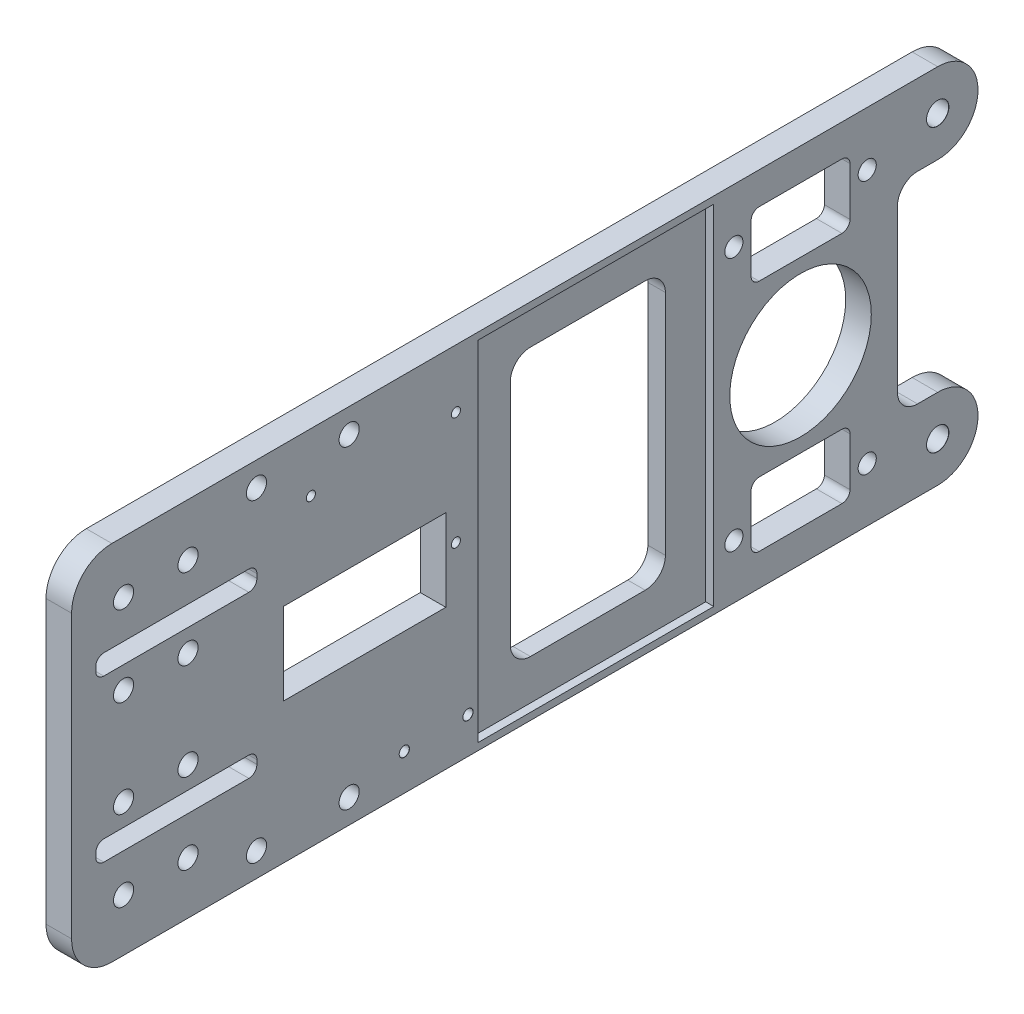
from build123d import *

# Parameters (mm, degrees)
SKETCH1_W                            = 90
SKETCH1_H                            = 225
SKETCH1_R                            = 17.5641
BOSS_EXTRUDE1_DEPTH                  = 3.175
SKETCH2_W                            = 78.1
SKETCH2_H                            = 43.1
BOSS_EXTRUDE2_DEPTH                  = 8.73125
M4_CLEARANCE_HOLE2_AT_2_COUNT        = 2
M4_CLEARANCE_HOLE2_AT_2_PITCH        = 33.1
M4_CLEARANCE_HOLE2_AT_3_COUNT        = 2
M4_CLEARANCE_HOLE2_AT_3_PITCH        = 71.254613886
M4_CLEARANCE_HOLE2_AT_4_COUNT        = 2
M4_CLEARANCE_HOLE2_AT_4_PITCH        = 63.1
SKETCH24_W                           = 78.1
SKETCH24_H                           = 43.1
BOSS_EXTRUDE3_DEPTH                  = 8.73125
TAP_DRILL_FOR_M4X0_7_TAP1_AT_2_COUNT = 2
TAP_DRILL_FOR_M4X0_7_TAP1_AT_2_PITCH = 33.1
TAP_DRILL_FOR_M4X0_7_TAP1_AT_3_COUNT = 2
TAP_DRILL_FOR_M4X0_7_TAP1_AT_3_PITCH = 71.254613886
TAP_DRILL_FOR_M4X0_7_TAP1_AT_4_COUNT = 2
TAP_DRILL_FOR_M4X0_7_TAP1_AT_4_PITCH = 63.1
TAP_DRILL_FOR_M3X0_5_TAP1_AT_2_COUNT = 2
TAP_DRILL_FOR_M3X0_5_TAP1_AT_2_PITCH = 15.8
SKETCH3_R                            = 17.5641
CUT_EXTRUDE3_DEPTH                   = 188.975896477
M5_CLEARANCE_HOLE1_AT_2_COUNT        = 2
M5_CLEARANCE_HOLE1_AT_2_PITCH        = 70
SKETCH14_W                           = 86.5
SKETCH14_H                           = 58.5
CUT_EXTRUDE4_DEPTH                   = 2
FILLET4_R                            = 10
FILLET5_R                            = 5
FILLET6_R                            = 5
SKETCH28_W                           = 15.5
SKETCH28_H                           = 20.75
SKETCH28_R                           = 1.5
BOSS_EXTRUDE4_DEPTH                  = 2.5
FILLET7_R                            = 1
SKETCH29_R                           = 1.5
BOSS_EXTRUDE5_DEPTH                  = 1.5
FILLET8_R                            = 0.5
SKETCH34_W                           = 1.1303
SKETCH34_H                           = 15.08125
TAP_DRILL_FOR_4_40_TAP1_AT_2_COUNT   = 2
TAP_DRILL_FOR_4_40_TAP1_AT_2_PITCH   = 36
TAP_DRILL_FOR_4_40_TAP1_AT_3_COUNT   = 2
TAP_DRILL_FOR_4_40_TAP1_AT_3_PITCH   = 45.607017004
TAP_DRILL_FOR_4_40_TAP1_AT_4_COUNT   = 2
TAP_DRILL_FOR_4_40_TAP1_AT_4_PITCH   = 28
SKETCH36_W                           = 16
SKETCH36_H                           = 24.55
CUT_EXTRUDE6_DEPTH                   = 189.979862105
FILLET9_R                            = 2
FILLET10_R                           = 2
CUT_EXTRUDE7_DEPTH                   = 189.079231247
CUT_EXTRUDE7_DEPTH_BACK              = 189.079231247
CUT_EXTRUDE8_DEPTH                   = 189.079231247
SKETCH39_R                           = 2.5
CUT_EXTRUDE9_DEPTH                   = 189.079231247
SKETCH40_W                           = 40.35
SKETCH40_H                           = 20.35
CUT_EXTRUDE10_DEPTH                  = 189.079231247
FILLET11_R                           = 2
BOSS_EXTRUDE6_DEPTH                  = 12
SKETCH43_W                           = 20.35
SKETCH43_H                           = 2
BOSS_EXTRUDE7_DEPTH                  = 2


with BuildPart() as part:
    # Sketch1 → Boss-Extrude1 (new, symmetric)
    with BuildSketch(Plane.YZ):
        with Locations((0, 68.45)):
            Rectangle(SKETCH1_W, SKETCH1_H)
        with Locations(Location((0, 0, 0), (0, 0, 270))):
            Circle(SKETCH1_R, mode=Mode.SUBTRACT)
    extrude(amount=BOSS_EXTRUDE1_DEPTH, both=True)


with BuildPart() as body_2:
    # Sketch2 → Boss-Extrude2 (new body)
    with BuildSketch(Plane.YZ.offset(3.175)):
        Rectangle(SKETCH2_W, SKETCH2_H)
    extrude(amount=BOSS_EXTRUDE2_DEPTH)


with BuildPart() as m4_clearance_hole2_tool:
    # Sketch23 → M4 Clearance Hole2 (revolve)
    with BuildSketch(Plane(origin=(11.90625, -31.55, 16.55), x_dir=(0, 0, -1), z_dir=(0, 1, 0))):
        Polygon((0, 0), (0, 15.08125), (2.25, 15.08125), (2.25, 0.025), (2.275, 0), align=None)
    m4_clearance_hole2 = revolve(axis=Axis((18.25625, -31.55, 16.55), (-1, 0, 0)))


with BuildPart() as part_1:
    add(part.part)

    # M4 Clearance Hole2: cut by m4_clearance_hole2_tool
    add(m4_clearance_hole2_tool.part, mode=Mode.SUBTRACT)


with BuildPart() as body_2_1:
    add(body_2.part)

    # M4 Clearance Hole2: cut by m4_clearance_hole2_tool
    add(m4_clearance_hole2_tool.part, mode=Mode.SUBTRACT)


with BuildPart() as m4_clearance_hole2_at_2_tool:
    # M4 Clearance Hole2 at 2: M4 Clearance Hole2 ×2
    with Locations(*[(0, 0, -i * M4_CLEARANCE_HOLE2_AT_2_PITCH) for i in range(1, M4_CLEARANCE_HOLE2_AT_2_COUNT)]):
        add(m4_clearance_hole2)


with BuildPart() as part_2:
    add(part_1.part)

    # M4 Clearance Hole2 at 2: cut by m4_clearance_hole2_at_2_tool
    add(m4_clearance_hole2_at_2_tool.part, mode=Mode.SUBTRACT)


with BuildPart() as body_2_2:
    add(body_2_1.part)

    # M4 Clearance Hole2 at 2: cut by m4_clearance_hole2_at_2_tool
    add(m4_clearance_hole2_at_2_tool.part, mode=Mode.SUBTRACT)


with BuildPart() as m4_clearance_hole2_at_3_tool:
    # M4 Clearance Hole2 at 3: M4 Clearance Hole2 ×2
    with Locations(*[Vector(0, 0.8855566897214588, -0.4645313221835228) * (i * M4_CLEARANCE_HOLE2_AT_3_PITCH) for i in range(1, M4_CLEARANCE_HOLE2_AT_3_COUNT)]):
        add(m4_clearance_hole2)


with BuildPart() as part_3:
    add(part_2.part)

    # M4 Clearance Hole2 at 3: cut by m4_clearance_hole2_at_3_tool
    add(m4_clearance_hole2_at_3_tool.part, mode=Mode.SUBTRACT)


with BuildPart() as body_2_3:
    add(body_2_2.part)

    # M4 Clearance Hole2 at 3: cut by m4_clearance_hole2_at_3_tool
    add(m4_clearance_hole2_at_3_tool.part, mode=Mode.SUBTRACT)


with BuildPart() as m4_clearance_hole2_at_4_tool:
    # M4 Clearance Hole2 at 4: M4 Clearance Hole2 ×2
    with Locations(*[(0, i * M4_CLEARANCE_HOLE2_AT_4_PITCH, 0) for i in range(1, M4_CLEARANCE_HOLE2_AT_4_COUNT)]):
        add(m4_clearance_hole2)


with BuildPart() as part_4:
    add(part_3.part)

    # M4 Clearance Hole2 at 4: cut by m4_clearance_hole2_at_4_tool
    add(m4_clearance_hole2_at_4_tool.part, mode=Mode.SUBTRACT)

    # Sketch10 → Tap Drill for M3x0.5 Tap1 (revolve, cut)
    with BuildSketch(Plane(origin=(3.175, -36, 98.35), x_dir=(0, 0, -1), z_dir=(0, 1, 0))):
        Polygon((0, 0), (0, 15.08125), (1.25, 15.08125), (1.25, 0.025), (1.275, 0), align=None)
    tap_drill_for_m3x0_5_tap1 = revolve(axis=Axis((9.525, -36, 98.35), (-1, 0, 0)), mode=Mode.SUBTRACT)

    # Tap Drill for M3x0.5 Tap1 at 2: Tap Drill for M3x0.5 Tap1 ×2
    with Locations(*[(0, 0, -i * TAP_DRILL_FOR_M3X0_5_TAP1_AT_2_PITCH) for i in range(1, TAP_DRILL_FOR_M3X0_5_TAP1_AT_2_COUNT)]):
        add(tap_drill_for_m3x0_5_tap1, mode=Mode.SUBTRACT)

    # Sketch12 → M5 Clearance Hole1 (revolve, cut)
    with BuildSketch(Plane(origin=(3.175, -35, -34.05), x_dir=(0, 0, -1), z_dir=(0, 1, 0))):
        Polygon((0, 0), (0, 15.08125), (2.75, 15.08125), (2.75, 0.025), (2.775, 0), align=None)
    m5_clearance_hole1 = revolve(axis=Axis((9.525, -35, -34.05), (-1, 0, 0)), mode=Mode.SUBTRACT)

    # M5 Clearance Hole1 at 2: M5 Clearance Hole1 ×2
    with Locations(*[(0, i * M5_CLEARANCE_HOLE1_AT_2_PITCH, 0) for i in range(1, M5_CLEARANCE_HOLE1_AT_2_COUNT)]):
        add(m5_clearance_hole1, mode=Mode.SUBTRACT)

    # Sketch14 → Cut-Extrude4 (cut)
    with BuildSketch(Plane.YZ.offset(3.175)):
        with Locations((0, 50.8)):
            Rectangle(SKETCH14_W, SKETCH14_H)
    extrude(amount=-CUT_EXTRUDE4_DEPTH, mode=Mode.SUBTRACT)

    # Fillet4
    fillet4_edges = [part_4.edges().sort_by_distance(p)[0] for p in [
        (0, -45, 180.95),
        (0, 45, 180.95),
        (0, 45, -44.05),
        (0, -45, -44.05),
    ]]
    fillet(fillet4_edges, radius=FILLET4_R)

    # Sketch34 → Tap Drill for #4-40 Tap1 (revolve, cut)
    with BuildSketch(Plane(origin=(3.175, 2.5, 121.55), x_dir=(0, 0, -1), z_dir=(0, 1, 0))):
        with Locations((0.56515, 7.540625)):
            Rectangle(SKETCH34_W, SKETCH34_H)
    tap_drill_for_4_40_tap1 = revolve(axis=Axis((9.525, 2.5, 121.55), (-1, 0, 0)), mode=Mode.SUBTRACT)

    # Tap Drill for #4-40 Tap1 at 2: Tap Drill for #4-40 Tap1 ×2
    with Locations(*[(0, 0, -i * TAP_DRILL_FOR_4_40_TAP1_AT_2_PITCH) for i in range(1, TAP_DRILL_FOR_4_40_TAP1_AT_2_COUNT)]):
        add(tap_drill_for_4_40_tap1, mode=Mode.SUBTRACT)

    # Tap Drill for #4-40 Tap1 at 3: Tap Drill for #4-40 Tap1 ×2
    with Locations(*[Vector(0, 0.6139406135149202, -0.7893522173763264) * (i * TAP_DRILL_FOR_4_40_TAP1_AT_3_PITCH) for i in range(1, TAP_DRILL_FOR_4_40_TAP1_AT_3_COUNT)]):
        add(tap_drill_for_4_40_tap1, mode=Mode.SUBTRACT)

    # Tap Drill for #4-40 Tap1 at 4: Tap Drill for #4-40 Tap1 ×2
    with Locations(*[(0, i * TAP_DRILL_FOR_4_40_TAP1_AT_4_PITCH, 0) for i in range(1, TAP_DRILL_FOR_4_40_TAP1_AT_4_COUNT)]):
        add(tap_drill_for_4_40_tap1, mode=Mode.SUBTRACT)


with BuildPart() as body_2_4:
    add(body_2_3.part)

    # M4 Clearance Hole2 at 4: cut by m4_clearance_hole2_at_4_tool
    add(m4_clearance_hole2_at_4_tool.part, mode=Mode.SUBTRACT)


with BuildPart() as body_3:
    # Sketch24 → Boss-Extrude3 (new body)
    with BuildSketch(Plane(origin=(-3.175, 0, 0), x_dir=(0, -1, 0), z_dir=(-1, 0, 0))):
        Rectangle(SKETCH24_W, SKETCH24_H)
    extrude(amount=BOSS_EXTRUDE3_DEPTH)

    # Sketch27 → Tap Drill for M4x0.7 Tap1 (revolve, cut)
    with BuildSketch(Plane(origin=(-11.90625, 31.55, 16.55), x_dir=(0, 0, 1), z_dir=(0, 1, 0))):
        Polygon((0, 0), (0, 9.722670021), (1.65, 8.73125), (1.65, 0.025), (1.675, 0), align=None)
    tap_drill_for_m4x0_7_tap1 = revolve(axis=Axis((-18.25625, 31.55, 16.55), (1, 0, 0)), mode=Mode.SUBTRACT)

    # Tap Drill for M4x0.7 Tap1 at 2: Tap Drill for M4x0.7 Tap1 ×2
    with Locations(*[(0, 0, -i * TAP_DRILL_FOR_M4X0_7_TAP1_AT_2_PITCH) for i in range(1, TAP_DRILL_FOR_M4X0_7_TAP1_AT_2_COUNT)]):
        add(tap_drill_for_m4x0_7_tap1, mode=Mode.SUBTRACT)

    # Tap Drill for M4x0.7 Tap1 at 3: Tap Drill for M4x0.7 Tap1 ×2
    with Locations(*[Vector(0, -0.8855566897214588, -0.4645313221835228) * (i * TAP_DRILL_FOR_M4X0_7_TAP1_AT_3_PITCH) for i in range(1, TAP_DRILL_FOR_M4X0_7_TAP1_AT_3_COUNT)]):
        add(tap_drill_for_m4x0_7_tap1, mode=Mode.SUBTRACT)

    # Tap Drill for M4x0.7 Tap1 at 4: Tap Drill for M4x0.7 Tap1 ×2
    with Locations(*[(0, -i * TAP_DRILL_FOR_M4X0_7_TAP1_AT_4_PITCH, 0) for i in range(1, TAP_DRILL_FOR_M4X0_7_TAP1_AT_4_COUNT)]):
        add(tap_drill_for_m4x0_7_tap1, mode=Mode.SUBTRACT)


with BuildPart() as cut_extrude3_tool:
    # Sketch3 → Cut-Extrude3 (new, through all)
    with BuildSketch(Plane.YZ.offset(11.90625)):
        with Locations(Location((0, 0, 0), (0, 0, 270))):
            Circle(SKETCH3_R)
    extrude(amount=-CUT_EXTRUDE3_DEPTH)


with BuildPart() as body_2_5:
    add(body_2_4.part)

    # Cut-Extrude3: cut by cut_extrude3_tool
    add(cut_extrude3_tool.part, mode=Mode.SUBTRACT)

    # Fillet6
    fillet6_edges = [body_2_5.edges().sort_by_distance(p)[0] for p in [
        (7.540625, -39.05, 21.55),
        (7.540625, 39.05, 21.55),
        (7.540625, 39.05, -21.55),
        (7.540625, -39.05, -21.55),
    ]]
    fillet(fillet6_edges, radius=FILLET6_R)


with BuildPart() as body_3_1:
    add(body_3.part)

    # Cut-Extrude3: cut by cut_extrude3_tool
    add(cut_extrude3_tool.part, mode=Mode.SUBTRACT)

    # Fillet5
    fillet5_edges = [body_3_1.edges().sort_by_distance(p)[0] for p in [
        (-7.540625, -39.05, 21.55),
        (-7.540625, -39.05, -21.55),
        (-7.540625, 39.05, -21.55),
        (-7.540625, 39.05, 21.55),
    ]]
    fillet(fillet5_edges, radius=FILLET5_R)


with BuildPart() as body_4:
    # Sketch28 → Boss-Extrude4 (new body)
    with BuildSketch(Plane.YZ.offset(3.175)):
        with Locations((-41.275, 90.45)):
            Rectangle(SKETCH28_W, SKETCH28_H)
        with Locations(Location((-36, 82.55, 0), (0, 0, 270))):
            Circle(SKETCH28_R, mode=Mode.SUBTRACT)
        with Locations(Location((-36, 98.35, 0), (0, 0, 270))):
            Circle(SKETCH28_R, mode=Mode.SUBTRACT)
    extrude(amount=BOSS_EXTRUDE4_DEPTH)

    # Fillet7
    fillet7_edges = [body_4.edges().sort_by_distance(p)[0] for p in [
        (4.425, -33.525, 80.075),
        (4.425, -49.025, 80.075),
        (4.425, -49.025, 100.825),
        (4.425, -33.525, 100.825),
    ]]
    fillet(fillet7_edges, radius=FILLET7_R)

    # Sketch29 → Boss-Extrude5 (add)
    with BuildSketch(Plane(origin=(3.175, 0, 0), x_dir=(0, -1, 0), z_dir=(-1, 0, 0))):
        with Locations(Location((47.025, 99.2, 0), (0, 0, 90))):
            Circle(SKETCH29_R)
        with Locations(Location((47.025, 95.7, 0), (0, 0, 90))):
            Circle(SKETCH29_R)
        with Locations(Location((47.025, 92.2, 0), (0, 0, 90))):
            Circle(SKETCH29_R)
        with Locations(Location((47.025, 88.7, 0), (0, 0, 90))):
            Circle(SKETCH29_R)
        with Locations(Location((47.025, 85.2, 0), (0, 0, 90))):
            Circle(SKETCH29_R)
        with Locations(Location((47.025, 81.7, 0), (0, 0, 90))):
            Circle(SKETCH29_R)
    extrude(amount=BOSS_EXTRUDE5_DEPTH)

    # Fillet8
    fillet8_edges = [body_4.edges().sort_by_distance(p)[0] for p in [
        (1.675, -47.025, 97.7),
        (1.675, -47.025, 94.2),
        (1.675, -47.025, 90.7),
        (1.675, -47.025, 87.2),
        (1.675, -47.025, 83.7),
        (1.675, -47.025, 80.2),
    ]]
    fillet(fillet8_edges, radius=FILLET8_R)


with BuildPart() as cut_extrude6_tool:
    # Sketch36 → Cut-Extrude6 (new, through all)
    with BuildSketch(Plane.YZ.offset(11.90625)):
        with Locations((-29.05, 0)):
            Rectangle(SKETCH36_W, SKETCH36_H)
        with Locations((29.05, 0)):
            Rectangle(SKETCH36_W, SKETCH36_H)
    extrude(amount=-CUT_EXTRUDE6_DEPTH)


with BuildPart() as part_5:
    add(part_4.part)

    # Cut-Extrude6: cut by cut_extrude6_tool
    add(cut_extrude6_tool.part, mode=Mode.SUBTRACT)

    # Sketch37 → Cut-Extrude7 (cut, two sides: drawn at the far end of the back side and taken through both)
    with BuildSketch(Plane.YZ.offset(3.175).offset(-CUT_EXTRUDE7_DEPTH_BACK)):
        with BuildLine():
            Line((-20.5, 174.95), (-19.5, 174.95))
            ThreePointArc((-19.5, 174.95), (-18.085786438, 174.364213562), (-17.5, 172.95))
            Line((-17.5, 172.95), (-17.5, 136.95))
            ThreePointArc((-17.5, 136.95), (-18.085786438, 135.535786438), (-19.5, 134.95))
            Line((-19.5, 134.95), (-20.5, 134.95))
            ThreePointArc((-20.5, 134.95), (-21.914213562, 135.535786438), (-22.5, 136.95))
            Line((-22.5, 136.95), (-22.5, 172.95))
            ThreePointArc((-22.5, 172.95), (-21.914213562, 174.364213562), (-20.5, 174.95))
        make_face()
        with BuildLine():
            Line((17.5, 172.95), (17.5, 136.95))
            ThreePointArc((17.5, 136.95), (18.085786438, 135.535786438), (19.5, 134.95))
            Line((19.5, 134.95), (20.5, 134.95))
            ThreePointArc((20.5, 134.95), (21.914213562, 135.535786438), (22.5, 136.95))
            Line((22.5, 136.95), (22.5, 172.95))
            ThreePointArc((22.5, 172.95), (21.914213562, 174.364213562), (20.5, 174.95))
            Line((20.5, 174.95), (19.5, 174.95))
            ThreePointArc((19.5, 174.95), (18.085786438, 174.364213562), (17.5, 172.95))
        make_face()
    extrude(amount=CUT_EXTRUDE7_DEPTH + CUT_EXTRUDE7_DEPTH_BACK, mode=Mode.SUBTRACT)

    # Sketch38 → Cut-Extrude8 (cut, through all)
    with BuildSketch(Plane.YZ.offset(3.175)):
        with BuildLine():
            ThreePointArc((-33.25, 65.05), (-31.785533906, 68.585533906), (-28.25, 70.05))
            Line((-28.25, 70.05), (28.25, 70.05))
            ThreePointArc((28.25, 70.05), (31.785533906, 68.585533906), (33.25, 65.05))
            Line((33.25, 65.05), (33.25, 36.55))
            ThreePointArc((33.25, 36.55), (31.785533906, 33.014466094), (28.25, 31.55))
            Line((28.25, 31.55), (-28.25, 31.55))
            ThreePointArc((-28.25, 31.55), (-31.785533906, 33.014466094), (-33.25, 36.55))
            Line((-33.25, 36.55), (-33.25, 65.05))
        make_face()
        with BuildLine():
            Line((20, -24.05), (0, -24.05))
            Line((0, -24.05), (0, -44.05))
            Line((0, -44.05), (25, -44.05))
            Line((25, -44.05), (35, -44.05))
            ThreePointArc((35, -44.05), (27.928932188, -41.121067812), (25, -34.05))
            Line((25, -34.05), (25, -29.05))
            ThreePointArc((25, -29.05), (23.535533906, -25.514466094), (20, -24.05))
        make_face()
        with BuildLine():
            Line((0, -24.05), (-20, -24.05))
            ThreePointArc((-20, -24.05), (-23.535533906, -25.514466094), (-25, -29.05))
            Line((-25, -29.05), (-25, -34.05))
            ThreePointArc((-25, -34.05), (-27.928932188, -41.121067812), (-35, -44.05))
            Line((-35, -44.05), (-25, -44.05))
            Line((-25, -44.05), (0, -44.05))
            Line((0, -44.05), (0, -24.05))
        make_face()
    extrude(amount=-CUT_EXTRUDE8_DEPTH, mode=Mode.SUBTRACT)

    # Sketch39 → Cut-Extrude9 (cut, through all)
    with BuildSketch(Plane.YZ.offset(3.175)):
        with Locations(Location((39, 112.05, 0), (0, 0, 270))):
            Circle(SKETCH39_R)
        with Locations(Location((32, 168.05, 0), (0, 0, 270))):
            Circle(SKETCH39_R)
        with Locations(Location((32, 152.05, 0), (0, 0, 270))):
            Circle(SKETCH39_R)
        with Locations(Location((12, 168.05, 0), (0, 0, 270))):
            Circle(SKETCH39_R)
        with Locations(Location((12, 152.05, 0), (0, 0, 270))):
            Circle(SKETCH39_R)
        with Locations(Location((39, 135.05, 0), (0, 0, 270))):
            Circle(SKETCH39_R)
        with Locations(Location((-39, 135.05, 0), (0, 0, 270))):
            Circle(SKETCH39_R)
        with Locations(Location((-12, 152.05, 0), (0, 0, 270))):
            Circle(SKETCH39_R)
        with Locations(Location((-12, 168.05, 0), (0, 0, 270))):
            Circle(SKETCH39_R)
        with Locations(Location((-32, 152.05, 0), (0, 0, 270))):
            Circle(SKETCH39_R)
        with Locations(Location((-32, 168.05, 0), (0, 0, 270))):
            Circle(SKETCH39_R)
        with Locations(Location((-39, 112.05, 0), (0, 0, 270))):
            Circle(SKETCH39_R)
    extrude(amount=-CUT_EXTRUDE9_DEPTH, mode=Mode.SUBTRACT)

    # Sketch40 → Cut-Extrude10 (cut, through all)
    with BuildSketch(Plane(origin=(3.175, 0, 0), x_dir=(0, 0, -1), z_dir=(1, 0, 0))):
        with Locations((-108.225, 0)):
            Rectangle(SKETCH40_W, SKETCH40_H)
    extrude(amount=-CUT_EXTRUDE10_DEPTH, mode=Mode.SUBTRACT)

    # Fillet11
    fillet11_edges = [part_5.edges().sort_by_distance(p)[0] for p in [
        (0, -37.05, -12.275),
        (0, -37.05, 12.275),
        (0, -21.05, 12.275),
        (0, -21.05, -12.275),
        (0, 21.05, 12.275),
        (0, 37.05, 12.275),
        (0, 37.05, -12.275),
        (0, 21.05, -12.275),
    ]]
    fillet(fillet11_edges, radius=FILLET11_R)

    # Sketch42 → Boss-Extrude6 (add)
    with BuildSketch(Plane.YZ.offset(-3.175)):
        Polygon((-12.175, 130.4), (12.175, 130.4), (12.175, 126.4), (10.175, 126.4), (10.175, 128.4), (-10.175, 128.4), (-10.175, 126.4), (-12.175, 126.4), align=None)
    extrude(amount=-BOSS_EXTRUDE6_DEPTH)

    # Sketch43 → Boss-Extrude7 (add)
    with BuildSketch(Plane(origin=(-15.175, 0, 0), x_dir=(0, -1, 0), z_dir=(-1, 0, 0))):
        with Locations((0, 127.4)):
            Rectangle(SKETCH43_W, SKETCH43_H)
    extrude(amount=-BOSS_EXTRUDE7_DEPTH)


with BuildPart() as body_2_6:
    add(body_2_5.part)

    # Cut-Extrude6: cut by cut_extrude6_tool
    add(cut_extrude6_tool.part, mode=Mode.SUBTRACT)

    # Fillet9
    fillet9_edges = [body_2_6.edges().sort_by_distance(p)[0] for p in [
        (7.540625, -37.05, -12.275),
        (7.540625, -37.05, 12.275),
        (7.540625, -21.05, 12.275),
        (7.540625, -21.05, -12.275),
        (7.540625, 21.05, 12.275),
        (7.540625, 37.05, 12.275),
        (7.540625, 37.05, -12.275),
        (7.540625, 21.05, -12.275),
    ]]
    fillet(fillet9_edges, radius=FILLET9_R)


with BuildPart() as body_3_2:
    add(body_3_1.part)

    # Cut-Extrude6: cut by cut_extrude6_tool
    add(cut_extrude6_tool.part, mode=Mode.SUBTRACT)

    # Fillet10
    fillet10_edges = [body_3_2.edges().sort_by_distance(p)[0] for p in [
        (-7.540625, -37.05, -12.275),
        (-7.540625, -37.05, 12.275),
        (-7.540625, -21.05, 12.275),
        (-7.540625, -21.05, -12.275),
        (-7.540625, 21.05, 12.275),
        (-7.540625, 37.05, 12.275),
        (-7.540625, 37.05, -12.275),
        (-7.540625, 21.05, -12.275),
    ]]
    fillet(fillet10_edges, radius=FILLET10_R)


solid = part_5.part
